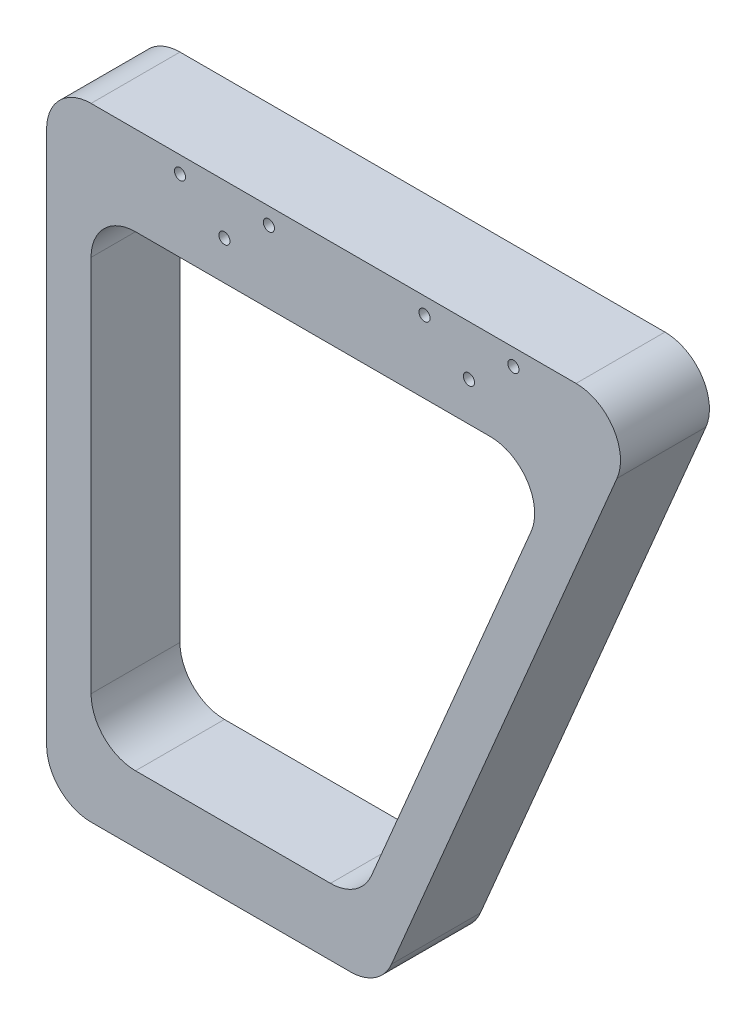
from build123d import *

# Parameters (mm, degrees)
BOSS_EXTRUDE2_DEPTH = 40
FILLET3_R           = 20
SKETCH2_R           = 2.5
CUT_EXTRUDE1_DEPTH  = 10


with BuildPart() as part:
    # Sketch1 → Boss-Extrude2 (new body)
    with BuildSketch(Plane.XY):
        Polygon((-310.658255987, -135.320069059), (-160.658255987, -135.320069059), (-42.316331357, 144.679930941), (-310.658255987, 144.679930941), align=None)
        Polygon((-290.658255987, 104.679930941), (-80.935291782, 104.679930941), (-169.691735254, -105.320069059), (-290.658255987, -105.320069059), align=None, mode=Mode.SUBTRACT)
    extrude(amount=BOSS_EXTRUDE2_DEPTH)

    # Fillet3
    fillet3_edges = [part.edges().sort_by_distance(p)[0] for p in [
        (-80.935291782, 104.679930941, 20),
        (-290.658255987, 104.679930941, 20),
        (-290.658255987, -105.320069059, 20),
        (-169.691735254, -105.320069059, 20),
        (-42.316331357, 144.679930941, 20),
        (-160.658255987, -135.320069059, 20),
        (-310.658255987, -135.320069059, 20),
        (-310.658255987, 144.679930941, 20),
    ]]
    fillet(fillet3_edges, radius=FILLET3_R)

    # Sketch2 → Cut-Extrude1 (cut)
    with BuildSketch(Plane.XY.offset(40)):
        with Locations((-250.658255987, 137.179930941)):
            Circle(SKETCH2_R)
        with Locations((-210.658255987, 137.179930941)):
            Circle(SKETCH2_R)
        with Locations((-230.658255987, 122.179930941)):
            Circle(SKETCH2_R)
    cut_extrude1 = extrude(amount=-CUT_EXTRUDE1_DEPTH, mode=Mode.SUBTRACT)

    # Mirror1: Cut-Extrude1 across plane
    add(cut_extrude1.mirror(Plane.ZY.offset(175.658255987)), mode=Mode.SUBTRACT)


solid = part.part
